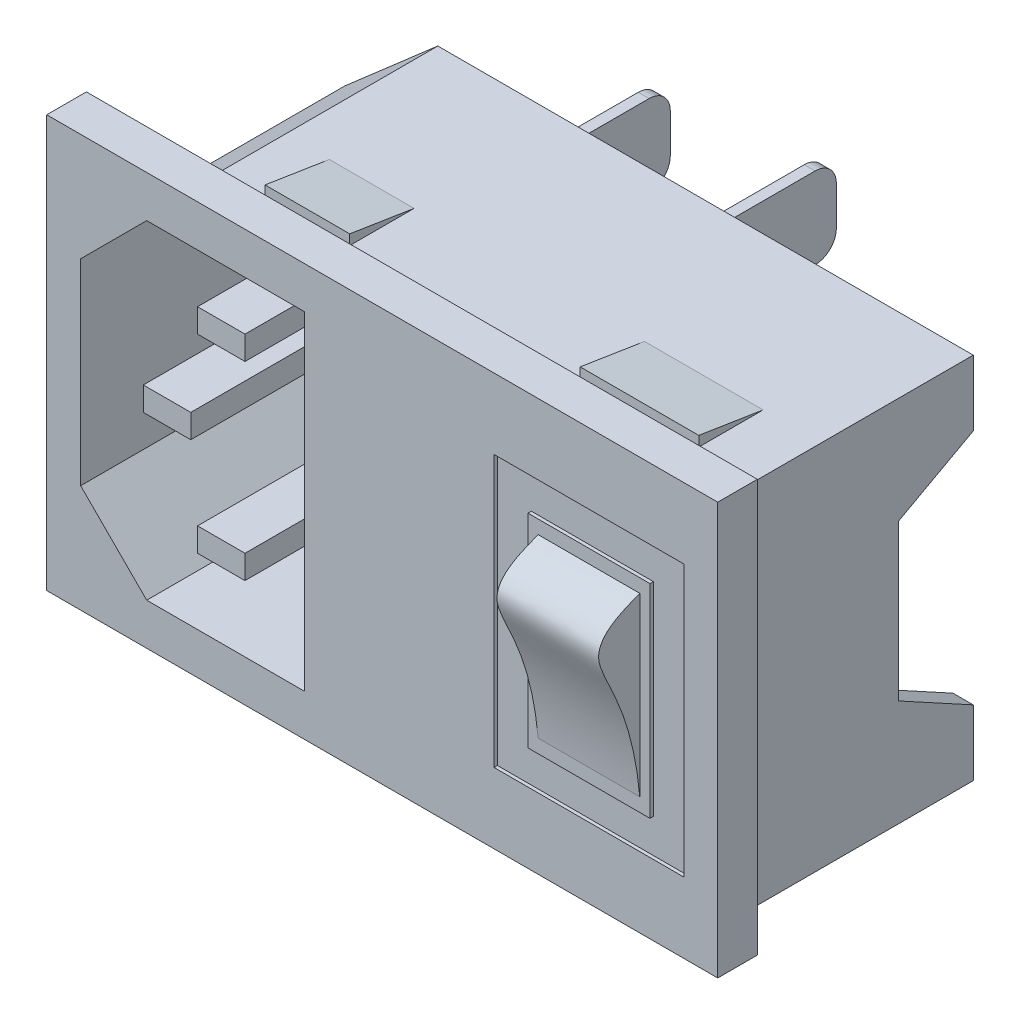
from build123d import *

# Parameters (mm, degrees)
SKETCH1_W           = 50.292
SKETCH1_H           = 30.8864
BOSS_EXTRUDE1_DEPTH = 2.9718
SKETCH2_W           = 47.0916
SKETCH2_H           = 27.6225
BOSS_EXTRUDE2_DEPTH = 17.78
CUT_EXTRUDE1_DEPTH  = 17.78
SKETCH4_W           = 15.24
SKETCH4_H           = 24.384
CUT_EXTRUDE2_DEPTH  = 7.62
CUT_EXTRUDE3_REACH  = 62.341
SKETCH6_W           = 0.8128
SKETCH6_H           = 6.096
BOSS_EXTRUDE3_DEPTH = 9.398
SKETCH7_W           = 5.08
SKETCH7_H           = 0.8128
BOSS_EXTRUDE4_DEPTH = 7.62
FILLET1_R           = 1.5875
CUT_EXTRUDE4_DEPTH  = 19.05
SKETCH9_W           = 3.556
SKETCH9_H           = 1.778
BOSS_EXTRUDE5_DEPTH = 18.415
SKETCH10_W          = 14.224
SKETCH10_H          = 20.32
SKETCH10_W_2        = 9.144
SKETCH10_H_2        = 15.24
CUT_EXTRUDE5_DEPTH  = 0.254
BOSS_EXTRUDE6_START = -9.652
BOSS_EXTRUDE6_DEPTH = 3.81
BOSS_EXTRUDE7_START = -4.318
BOSS_EXTRUDE7_DEPTH = 8.89
BOSS_EXTRUDE8_START = -30.48
BOSS_EXTRUDE8_DEPTH = 6.35


with BuildPart() as part:
    # Sketch1 → Boss-Extrude1 (new body)
    with BuildSketch(Plane.XY):
        with Locations((25.146, 15.4432)):
            Rectangle(SKETCH1_W, SKETCH1_H)
    extrude(amount=BOSS_EXTRUDE1_DEPTH)

    # Sketch2 → Boss-Extrude2 (add)
    with BuildSketch(Plane(origin=(0, 0, 0), x_dir=(-1, 0, 0), z_dir=(0, 0, -1))):
        with Locations((-25.146, 15.4432)):
            Rectangle(SKETCH2_W, SKETCH2_H)
    extrude(amount=BOSS_EXTRUDE2_DEPTH)

    # Sketch3 → Cut-Extrude1 (cut)
    with BuildSketch(Plane(origin=(0, 0, -17.78), x_dir=(-1, 0, 0), z_dir=(0, 0, -1))):
        Polygon((-8.5598, 29.25445), (-1.6002, 23.1902), (-1.6002, 29.25445), align=None)
        Polygon((-1.6002, 1.63195), (-1.6002, 7.6962), (-8.5598, 1.63195), align=None)
    extrude(amount=-CUT_EXTRUDE1_DEPTH, mode=Mode.SUBTRACT)

    # Sketch4 → Cut-Extrude2 (cut)
    with BuildSketch(Plane(origin=(0, 0, -17.78), x_dir=(-1, 0, 0), z_dir=(0, 0, -1))):
        with Locations((-39.5478, 15.4432)):
            Rectangle(SKETCH4_W, SKETCH4_H)
    extrude(amount=-CUT_EXTRUDE2_DEPTH, mode=Mode.SUBTRACT)

    # Sketch5 → Cut-Extrude3 (cut, up to next)
    with BuildSketch(Plane(origin=(48.6918, 0, 0), x_dir=(0, 0, -1), z_dir=(1, 0, 0)), mode=Mode.PRIVATE) as cut_extrude3_sk1:
        Polygon((17.78, 24.3332), (17.78, 6.5532), (12.192, 9.6012), (12.192, 21.2852), align=None)
    cut_extrude3_tool1 = extrude(cut_extrude3_sk1.sketch, amount=-CUT_EXTRUDE3_REACH, mode=Mode.PRIVATE) & part.part
    add(cut_extrude3_tool1.solids().sort_by_distance((48.6918, 15.4432, -15.17869))[0], mode=Mode.SUBTRACT)

    # Sketch6 → Boss-Extrude3 (add)
    with BuildSketch(Plane(origin=(0, 0, -17.78), x_dir=(-1, 0, 0), z_dir=(0, 0, -1))):
        with Locations((-5.5626, 15.4432)):
            Rectangle(SKETCH6_W, SKETCH6_H)
        with Locations((-16.1798, 22.90445)):
            Rectangle(SKETCH6_W, SKETCH6_H)
        with Locations((-28.6258, 24.42845)):
            Rectangle(SKETCH6_W, SKETCH6_H)
    extrude(amount=BOSS_EXTRUDE3_DEPTH)

    # Sketch7 → Boss-Extrude4 (add)
    with BuildSketch(Plane(origin=(0, 0, -10.16), x_dir=(-1, 0, 0), z_dir=(0, 0, -1))):
        with Locations((-39.5478, 8.33755)):
            Rectangle(SKETCH7_W, SKETCH7_H)
        with Locations((-39.5478, 15.14475)):
            Rectangle(SKETCH7_W, SKETCH7_H)
    extrude(amount=BOSS_EXTRUDE4_DEPTH)

    # Fillet1
    fillet1_edges = [part.edges().sort_by_distance(p)[0] for p in [
        (42.0878, 8.33755, -17.78),
        (37.0078, 8.33755, -17.78),
        (42.0878, 15.14475, -17.78),
        (37.0078, 15.14475, -17.78),
        (5.5626, 12.3952, -27.178),
        (5.5626, 18.4912, -27.178),
        (16.1798, 19.85645, -27.178),
        (16.1798, 25.95245, -27.178),
        (28.6258, 21.38045, -27.178),
        (28.6258, 27.47645, -27.178),
    ]]
    fillet(fillet1_edges, radius=FILLET1_R)

    # Sketch8 → Cut-Extrude4 (cut)
    with BuildSketch(Plane.XY.offset(2.9718)):
        Polygon((19.304, 27.7622), (19.304, 3.1242), (7.493, 3.1242), (2.54, 8.0772), (2.54, 15.4432), (2.54, 22.8092), (7.493, 27.7622), align=None)
    extrude(amount=-CUT_EXTRUDE4_DEPTH, mode=Mode.SUBTRACT)

    # Sketch9 → Boss-Extrude5 (add)
    with BuildSketch(Plane.XY.offset(-16.0782)):
        with Locations((12.446, 22.5552)):
            Rectangle(SKETCH9_W, SKETCH9_H)
        with Locations((8.382, 15.4432)):
            Rectangle(SKETCH9_W, SKETCH9_H)
        with Locations((12.446, 8.3312)):
            Rectangle(SKETCH9_W, SKETCH9_H)
    extrude(amount=BOSS_EXTRUDE5_DEPTH)

    # Sketch10 → Cut-Extrude5 (cut)
    with BuildSketch(Plane.XY.offset(2.9718)):
        with Locations((40.64, 15.4432)):
            Rectangle(SKETCH10_W, SKETCH10_H)
        with Locations((40.64, 15.4432)):
            Rectangle(SKETCH10_W_2, SKETCH10_H_2, mode=Mode.SUBTRACT)
    extrude(amount=-CUT_EXTRUDE5_DEPTH, mode=Mode.SUBTRACT)

    # Sketch11 → Boss-Extrude6 (add, symmetric)
    with BuildSketch(Plane(origin=(50.292, 0, 0), x_dir=(0, 0, -1), z_dir=(1, 0, 0)).offset(BOSS_EXTRUDE6_START)):
        with BuildLine():
            Line((-2.9718, 15.4432), (-2.9718, 22.0472))
            add(Edge.make_bspline(
                [(-2.9718, 8.8392), (-3.553872131, 15.290477118), (-8.392581533, 20.316911693), (-3.884219092, 21.66276478), (-2.9718, 22.0472)],
                knots=[0, 0, 0, 0, 0.486211791, 1, 1, 1, 1], degree=3))
            Line((-2.9718, 8.8392), (-2.9718, 15.4432))
        make_face()
    extrude(amount=BOSS_EXTRUDE6_DEPTH, both=True)

    # Sketch12 → Boss-Extrude7 (add)
    with BuildSketch(Plane(origin=(48.6918, 0, 0), x_dir=(0, 0, -1), z_dir=(1, 0, 0)).offset(BOSS_EXTRUDE7_START)):
        Polygon((1.524, 29.25445), (1.524, 30.01645), (6.35, 29.25445), align=None)
        Polygon((1.524, 1.63195), (1.524, 0.86995), (6.35, 1.63195), align=None)
    extrude(amount=-BOSS_EXTRUDE7_DEPTH)

    # Sketch12<2> → Boss-Extrude8 (add)
    with BuildSketch(Plane(origin=(48.6918, 0, 0), x_dir=(0, 0, -1), z_dir=(1, 0, 0)).offset(BOSS_EXTRUDE8_START)):
        Polygon((1.524, 29.25445), (1.524, 30.01645), (6.35, 29.25445), align=None)
        Polygon((1.524, 1.63195), (1.524, 0.86995), (6.35, 1.63195), align=None)
    extrude(amount=-BOSS_EXTRUDE8_DEPTH)


solid = part.part
